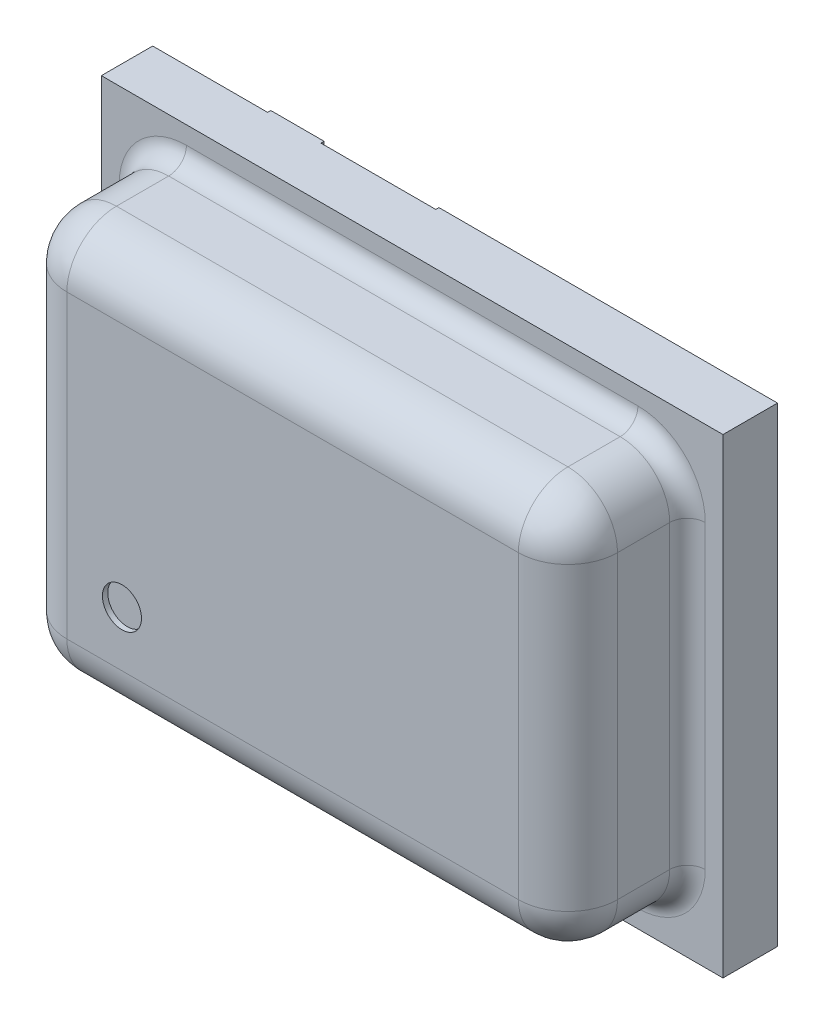
from build123d import *

# Parameters (mm, degrees)
SKETCH1_W           = 3.5
SKETCH1_H           = 2.65
BOSS_EXTRUDE1_DEPTH = 0.307
SKETCH2_W           = 3.1
SKETCH2_H           = 2.25
BOSS_EXTRUDE2_DEPTH = 0.673
FILLET1_R           = 0.279
SKETCH3_R           = 0.11
CUT_EXTRUDE1_DEPTH  = 0.03
FILLET2_R           = 0.1
SKETCH4_R           = 0.1625
CUT_EXTRUDE2_DEPTH  = 0.5
SKETCH5_W           = 0.647
SKETCH5_H           = 0.85
SKETCH5_R           = 0.8125
SKETCH5_R_2         = 0.5125
SKETCH5_R_3         = 0.2875
SKETCH5_R_4         = 0.1625
CUT_EXTRUDE3_DEPTH  = 0.018
BOSS_EXTRUDE3_START = 0.01801
SKETCH6_R           = 0.8125
SKETCH6_R_2         = 0.5125
SKETCH6_W           = 0.522
SKETCH6_H           = 0.725
BOSS_EXTRUDE3_DEPTH = 0.01801


with BuildPart() as part:
    # Sketch1 → Boss-Extrude1 (new body)
    with BuildSketch(Plane.XY):
        Rectangle(SKETCH1_W, SKETCH1_H)
    extrude(amount=BOSS_EXTRUDE1_DEPTH)

    # Sketch2 → Boss-Extrude2 (add)
    with BuildSketch(Plane.XY.offset(0.307)):
        Rectangle(SKETCH2_W, SKETCH2_H)
    extrude(amount=BOSS_EXTRUDE2_DEPTH)

    # Fillet1
    fillet1_edges = [part.edges().sort_by_distance(p)[0] for p in [
        (1.55, -1.125, 0.6435),
        (1.55, 1.125, 0.6435),
        (-1.55, 1.125, 0.6435),
        (-1.55, -1.125, 0.6435),
        (0, -1.125, 0.98),
        (1.55, 0, 0.98),
        (0, 1.125, 0.98),
        (-1.55, 0, 0.98),
    ]]
    fillet(fillet1_edges, radius=FILLET1_R)

    # Sketch3 → Cut-Extrude1 (cut)
    with BuildSketch(Plane.XY.offset(0.98)):
        with Locations((-0.961, -0.536)):
            Circle(SKETCH3_R)
    extrude(amount=-CUT_EXTRUDE1_DEPTH, mode=Mode.SUBTRACT)

    # Fillet2
    fillet2_edges = [part.edges().sort_by_distance(p)[0] for p in [
        (-1.55, 0, 0.307),
        (0, 1.125, 0.307),
        (1.55, 0, 0.307),
        (0, -1.125, 0.307),
        (-1.468282792, 1.043282792, 0.307),
        (1.468282792, 1.043282792, 0.307),
        (1.468282792, -1.043282792, 0.307),
        (-1.468282792, -1.043282792, 0.307),
    ]]
    fillet(fillet2_edges, radius=FILLET2_R)

    # Sketch4 → Cut-Extrude2 (cut)
    with BuildSketch(Plane(origin=(0, 0, 0), x_dir=(1, 0, 0), z_dir=(0, 0, -1))):
        with Locations(Location((0.71, 0, 0), (0, 0, 270))):
            Circle(SKETCH4_R)
    extrude(amount=-CUT_EXTRUDE2_DEPTH, mode=Mode.SUBTRACT)

    # Sketch5 → Cut-Extrude3 (cut)
    # profile 1 of 6: a face of its own
    with BuildSketch(Plane(origin=(0, 0, 0), x_dir=(1, 0, 0), z_dir=(0, 0, -1))):
        with Locations((-0.4795, 0.9)):
            Rectangle(SKETCH5_W, SKETCH5_H)
    # profile 2 of 6: a face of its own
    with BuildSketch(Plane(origin=(0, 0, 0), x_dir=(1, 0, 0), z_dir=(0, 0, -1))):
        with Locations((-1.4265, 0.9)):
            Rectangle(SKETCH5_W, SKETCH5_H)
    # profile 3 of 6: a face of its own
    with BuildSketch(Plane(origin=(0, 0, 0), x_dir=(1, 0, 0), z_dir=(0, 0, -1))):
        with Locations((-1.4265, -0.9)):
            Rectangle(SKETCH5_W, SKETCH5_H)
    # profile 4 of 6: a face of its own
    with BuildSketch(Plane(origin=(0, 0, 0), x_dir=(1, 0, 0), z_dir=(0, 0, -1))):
        with Locations((-0.4795, -0.9)):
            Rectangle(SKETCH5_W, SKETCH5_H)
    # profile 5 of 6: a face of its own
    with BuildSketch(Plane(origin=(0, 0, 0), x_dir=(1, 0, 0), z_dir=(0, 0, -1))):
        with Locations(Location((0.71, 0, 0), (0, 0, 270))):
            Circle(SKETCH5_R)
        with Locations(Location((0.71, 0, 0), (0, 0, 270))):
            Circle(SKETCH5_R_2, mode=Mode.SUBTRACT)
    # profile 6 of 6: a face of its own
    with BuildSketch(Plane(origin=(0, 0, 0), x_dir=(1, 0, 0), z_dir=(0, 0, -1))):
        with Locations(Location((0.71, 0, 0), (0, 0, 270))):
            Circle(SKETCH5_R_3)
        with Locations(Location((0.71, 0, 0), (0, 0, 270))):
            Circle(SKETCH5_R_4, mode=Mode.SUBTRACT)
    extrude(amount=-CUT_EXTRUDE3_DEPTH, mode=Mode.SUBTRACT)

    # Sketch6 → Boss-Extrude3 (add)
    # profile 1 of 5: a face of its own
    with BuildSketch(Plane(origin=(0, 0, 0.018), x_dir=(1, 0, 0), z_dir=(0, 0, -1)).offset(BOSS_EXTRUDE3_START)):
        with Locations(Location((0.71, 0, 0), (0, 0, 270))):
            Circle(SKETCH6_R)
        with Locations((0.71, 0)):
            Circle(SKETCH6_R_2, mode=Mode.SUBTRACT)
    # profile 2 of 5: a face of its own
    with BuildSketch(Plane(origin=(0, 0, 0.018), x_dir=(1, 0, 0), z_dir=(0, 0, -1)).offset(BOSS_EXTRUDE3_START)):
        with Locations((-1.364, 0.8375)):
            Rectangle(SKETCH6_W, SKETCH6_H)
    # profile 3 of 5: a face of its own
    with BuildSketch(Plane(origin=(0, 0, 0.018), x_dir=(1, 0, 0), z_dir=(0, 0, -1)).offset(BOSS_EXTRUDE3_START)):
        with Locations((-0.542, 0.8375)):
            Rectangle(SKETCH6_W, SKETCH6_H)
    # profile 4 of 5: a face of its own
    with BuildSketch(Plane(origin=(0, 0, 0.018), x_dir=(1, 0, 0), z_dir=(0, 0, -1)).offset(BOSS_EXTRUDE3_START)):
        with Locations((-0.542, -0.8375)):
            Rectangle(SKETCH6_W, SKETCH6_H)
    # profile 5 of 5: a face of its own
    with BuildSketch(Plane(origin=(0, 0, 0.018), x_dir=(1, 0, 0), z_dir=(0, 0, -1)).offset(BOSS_EXTRUDE3_START)):
        with Locations((-1.364, -0.8375)):
            Rectangle(SKETCH6_W, SKETCH6_H)
    extrude(amount=-BOSS_EXTRUDE3_DEPTH)


solid = part.part
